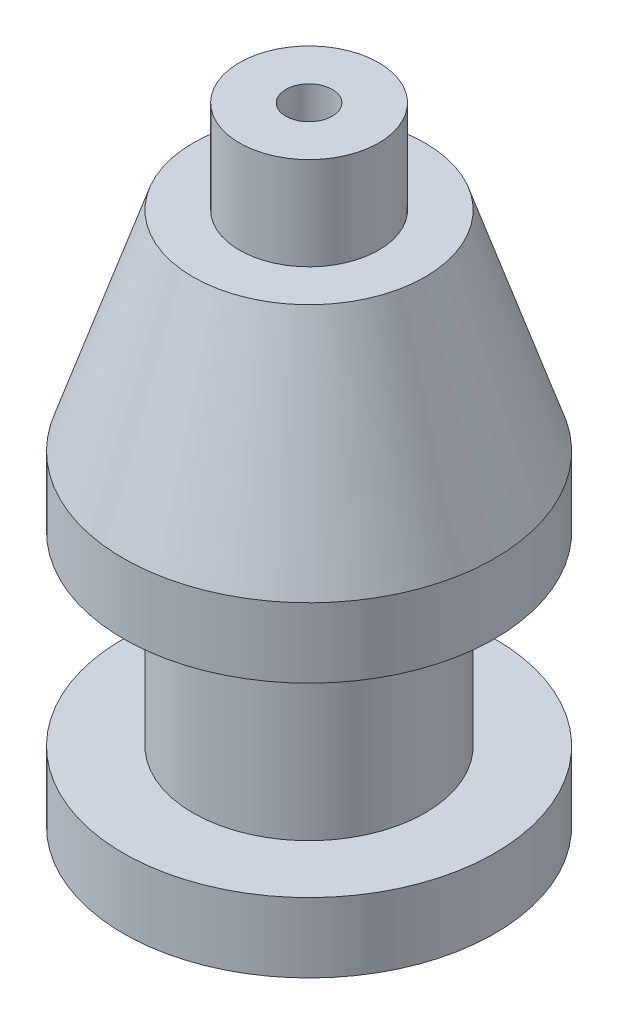
from build123d import *


with BuildPart() as part:
    # Sketch1 → Revolve1 (revolve)
    with BuildSketch(Plane.XY, mode=Mode.PRIVATE) as revolve1_sk:
        Polygon((10, -110), (80, -110), (80, -80), (50, -80), (50, 0), (80, 0), (80, 30), (50, 120), (30, 120), (30, 160), (10, 160), align=None)
    revolve(revolve1_sk.sketch.rotate(Axis((0, 0, 0), (0, 1, 0)), 90), axis=Axis((0, 0, 0), (0, 1, 0)))


solid = part.part
